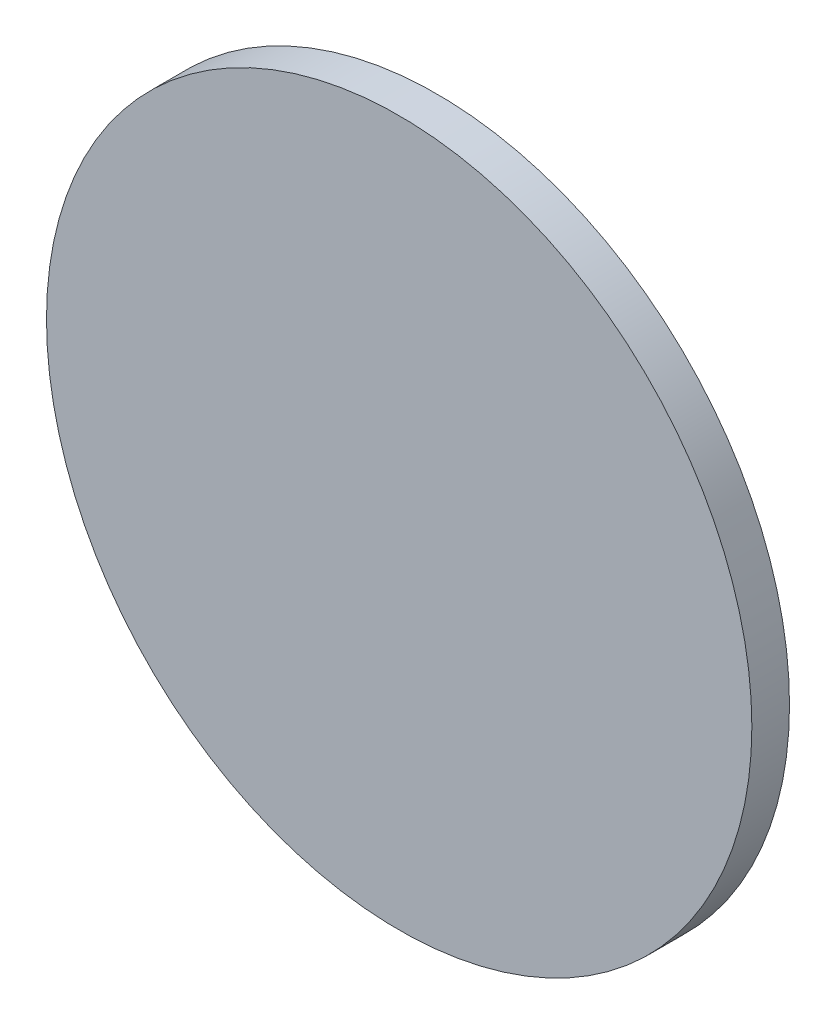
from build123d import *

# Parameters (mm, degrees)
SKETCH1_R           = 14.8
BOSS_EXTRUDE1_DEPTH = 1.58


with BuildPart() as part:
    # Sketch1 → Boss-Extrude1 (new body)
    with BuildSketch(Plane.XY):
        with Locations(Location((0, 0, 0), (0, 0, 180))):
            Circle(SKETCH1_R)
    extrude(amount=BOSS_EXTRUDE1_DEPTH)


solid = part.part
